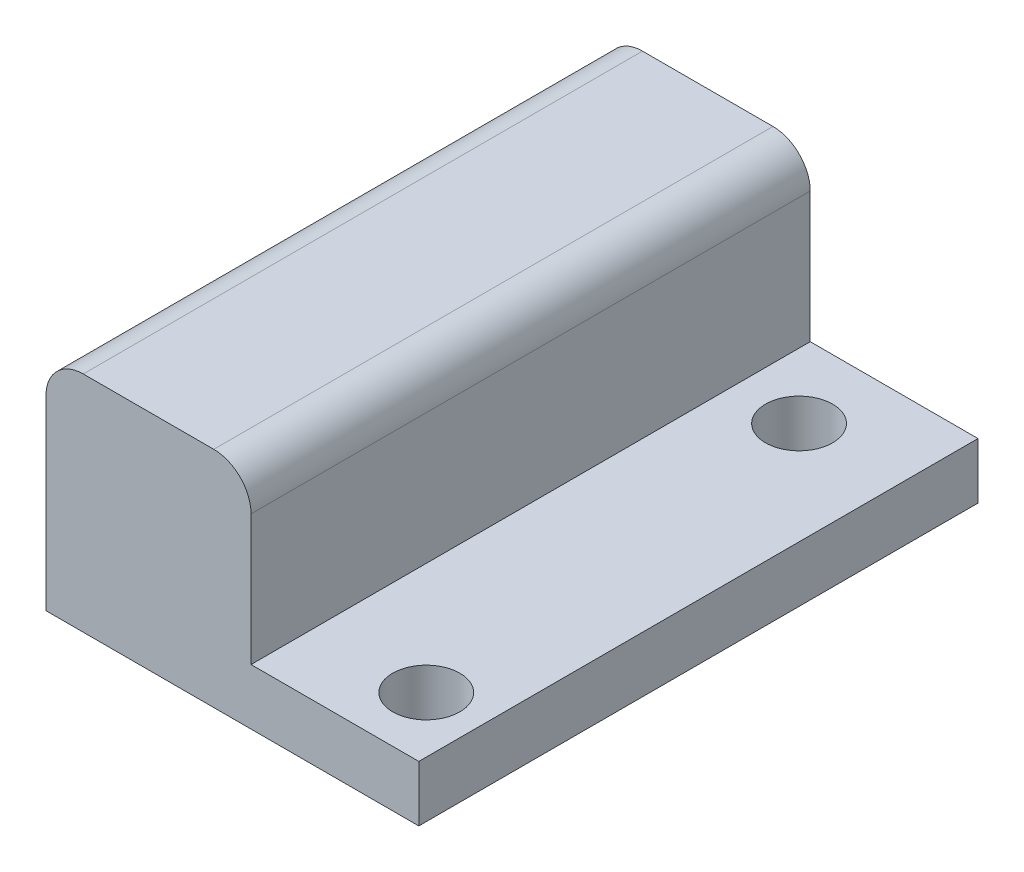
from build123d import *

# Parameters (mm, degrees)
SKETCH1_W           = 25.4
SKETCH1_H           = 38.1
SKETCH1_R           = 2.286
BOSS_EXTRUDE1_DEPTH = 3.81
BOSS_EXTRUDE2_DEPTH = 8.89
SKETCH3_W           = 13.97
SKETCH3_H           = 38.1
BOSS_EXTRUDE3_DEPTH = 2.54
CHAMFER1_SIZE       = 1.27
FILLET2_R           = 2.54


with BuildPart() as part:
    # Sketch1 → Boss-Extrude1 (new body)
    with BuildSketch(Plane(origin=(0, 0, 0), x_dir=(1, 0, 0), z_dir=(0, 1, 0))):
        with Locations((-7.112, -12.566479761)):
            Rectangle(SKETCH1_W, SKETCH1_H)
        with Locations(Location((-1.397, 1.276520239, 0), (0, 0, 90))):
            Circle(SKETCH1_R, mode=Mode.SUBTRACT)
        with Locations(Location((1.778, -27.298479761, 0), (0, 0, 90))):
            Circle(SKETCH1_R, mode=Mode.SUBTRACT)
    extrude(amount=BOSS_EXTRUDE1_DEPTH)

    # Sketch2 → Boss-Extrude2 (add)
    with BuildSketch(Plane(origin=(0, 3.81, 0), x_dir=(1, 0, 0), z_dir=(0, 1, 0))):
        Polygon((-19.812, 6.483520239), (-19.812, -31.616479761), (-5.842, -31.616479761), (-5.842, 6.483520239), (-8.382, 6.483520239), (-8.382, -29.076479761), (-17.272, -29.076479761), (-17.272, 6.483520239), align=None)
    extrude(amount=BOSS_EXTRUDE2_DEPTH)

    # Sketch3 → Boss-Extrude3 (add)
    with BuildSketch(Plane(origin=(0, 12.7, 0), x_dir=(1, 0, 0), z_dir=(0, 1, 0))):
        with Locations((-12.827, -12.566479761)):
            Rectangle(SKETCH3_W, SKETCH3_H)
    extrude(amount=BOSS_EXTRUDE3_DEPTH)

    # Chamfer1
    chamfer1_edges = [part.edges().sort_by_distance(p)[0] for p in [
        (-8.382, 12.7, 11.296479761),
        (-17.272, 12.7, 11.296479761),
    ]]
    chamfer(chamfer1_edges, length=CHAMFER1_SIZE)

    # Fillet2
    fillet2_edges = [part.edges().sort_by_distance(p)[0] for p in [
        (-19.812, 15.24, 12.566479761),
        (-5.842, 15.24, 12.566479761),
    ]]
    fillet(fillet2_edges, radius=FILLET2_R)


solid = part.part
